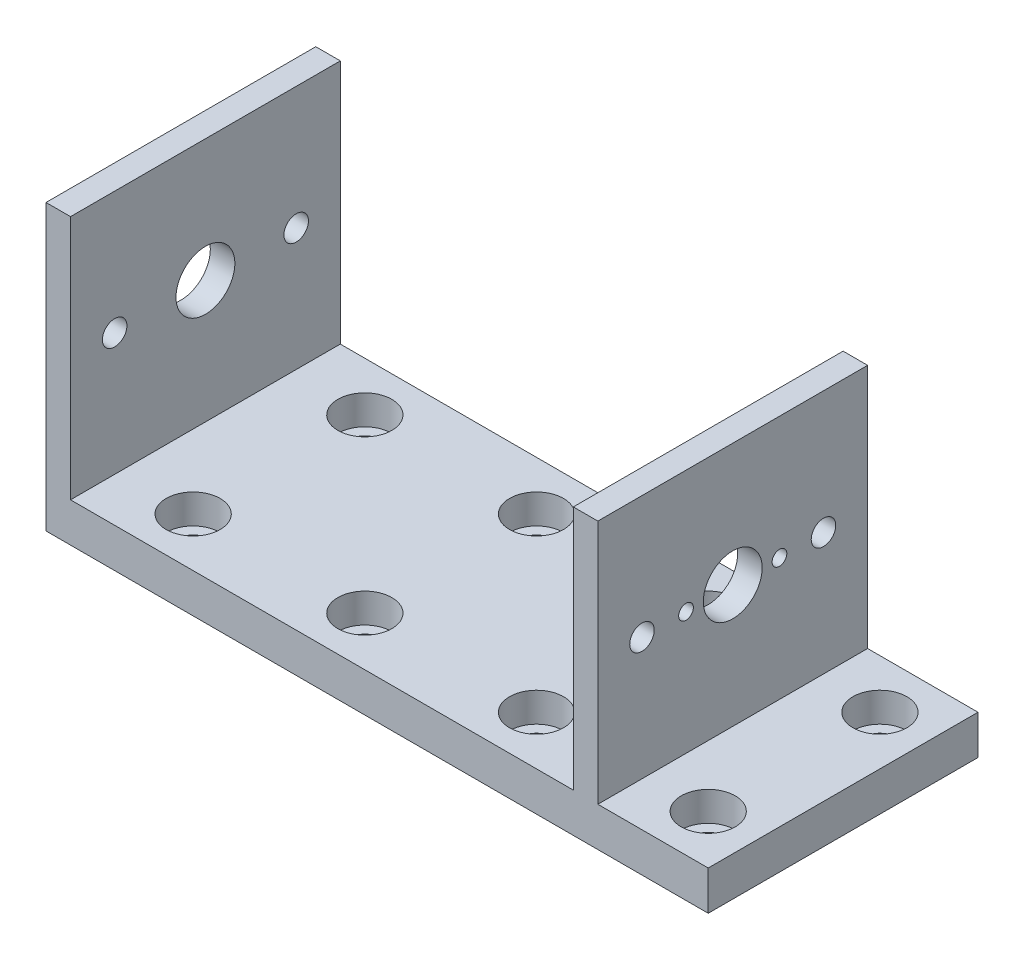
from build123d import *

# Parameters (mm, degrees)
SKETCH1_W               = 125
SKETCH1_H               = 55
SKETCH1_R               = 3.25
BOSS_EXTRUDE1_DEPTH     = 8
SKETCH5_R               = 5.5
CUT_EXTRUDE1_DEPTH      = 6
SKETCH3_W               = 55
SKETCH3_H               = 8
BOSS_EXTRUDE3_DEPTH     = 10
SKETCH4_W               = 5
SKETCH4_H               = 55
BOSS_EXTRUDE4_DEPTH     = 50
CUT_EXTRUDE2_DEPTH      = 150.483276657
CUT_EXTRUDE2_DEPTH_BACK = 150.483276657
SKETCH6_R               = 6
SKETCH6_R_2             = 2.5
SKETCH8_R               = 1.5
CUT_EXTRUDE3_DEPTH      = 10


with BuildPart() as part:
    # Sketch1 → Boss-Extrude1 (new body)
    with BuildSketch(Plane(origin=(0, 0, 0), x_dir=(1, 0, 0), z_dir=(0, 1, 0))):
        Rectangle(SKETCH1_W, SKETCH1_H)
        with Locations(Location((-52.5, 17.5, 0), (0, 0, 270))):
            Circle(SKETCH1_R, mode=Mode.SUBTRACT)
        with Locations(Location((-52.5, -17.5, 0), (0, 0, 90))):
            Circle(SKETCH1_R, mode=Mode.SUBTRACT)
        with Locations(Location((-17.5, -17.5, 0), (0, 0, 270))):
            Circle(SKETCH1_R, mode=Mode.SUBTRACT)
        with Locations(Location((-17.5, 17.5, 0), (0, 0, 90))):
            Circle(SKETCH1_R, mode=Mode.SUBTRACT)
        with Locations(Location((52.5, -17.5, 0), (0, 0, 270))):
            Circle(SKETCH1_R, mode=Mode.SUBTRACT)
        with Locations(Location((17.5, -17.5, 0), (0, 0, 90))):
            Circle(SKETCH1_R, mode=Mode.SUBTRACT)
        with Locations(Location((17.5, 17.5, 0), (0, 0, 270))):
            Circle(SKETCH1_R, mode=Mode.SUBTRACT)
        with Locations(Location((52.5, 17.5, 0), (0, 0, 90))):
            Circle(SKETCH1_R, mode=Mode.SUBTRACT)
    extrude(amount=BOSS_EXTRUDE1_DEPTH)

    # Sketch5 → Cut-Extrude1 (cut)
    with BuildSketch(Plane(origin=(0, 8, 0), x_dir=(1, 0, 0), z_dir=(0, 1, 0))):
        with Locations(Location((-52.5, 17.5, 0), (0, 0, 270))):
            Circle(SKETCH5_R)
        with Locations(Location((-17.5, 17.5, 0), (0, 0, 270))):
            Circle(SKETCH5_R)
        with Locations(Location((17.5, 17.5, 0), (0, 0, 270))):
            Circle(SKETCH5_R)
        with Locations(Location((52.5, 17.5, 0), (0, 0, 270))):
            Circle(SKETCH5_R)
        with Locations(Location((52.5, -17.5, 0), (0, 0, 270))):
            Circle(SKETCH5_R)
        with Locations(Location((17.5, -17.5, 0), (0, 0, 270))):
            Circle(SKETCH5_R)
        with Locations(Location((-17.5, -17.5, 0), (0, 0, 270))):
            Circle(SKETCH5_R)
        with Locations(Location((-52.5, -17.5, 0), (0, 0, 270))):
            Circle(SKETCH5_R)
    extrude(amount=-CUT_EXTRUDE1_DEPTH, mode=Mode.SUBTRACT)

    # Sketch3 → Boss-Extrude3 (add)
    with BuildSketch(Plane.ZY.offset(62.5)):
        with Locations((0, 4)):
            Rectangle(SKETCH3_W, SKETCH3_H)
    extrude(amount=BOSS_EXTRUDE3_DEPTH)

    # Sketch4 → Boss-Extrude4 (add)
    with BuildSketch(Plane(origin=(0, 8, 0), x_dir=(1, 0, 0), z_dir=(0, 1, 0))):
        with Locations((-70, 0)):
            Rectangle(SKETCH4_W, SKETCH4_H)
        with Locations((37.5, 0)):
            Rectangle(SKETCH4_W, SKETCH4_H)
    extrude(amount=BOSS_EXTRUDE4_DEPTH)

    # Sketch6 → Cut-Extrude2 (cut, two sides: drawn at the far end of the back side and taken through both)
    with BuildSketch(Plane.ZY.offset(72.5).offset(-CUT_EXTRUDE2_DEPTH_BACK)):
        with Locations((0, 33)):
            Circle(SKETCH6_R)
        with Locations((-18.5, 33)):
            Circle(SKETCH6_R_2)
        with Locations((18.5, 33)):
            Circle(SKETCH6_R_2)
    extrude(amount=CUT_EXTRUDE2_DEPTH + CUT_EXTRUDE2_DEPTH_BACK, mode=Mode.SUBTRACT)

    # Sketch8 → Cut-Extrude3 (cut)
    with BuildSketch(Plane(origin=(40, 0, 0), x_dir=(0, 0, -1), z_dir=(1, 0, 0))):
        with Locations((9.525, 33)):
            Circle(SKETCH8_R)
        with Locations((-9.525, 33)):
            Circle(SKETCH8_R)
    extrude(amount=-CUT_EXTRUDE3_DEPTH, mode=Mode.SUBTRACT)


solid = part.part
